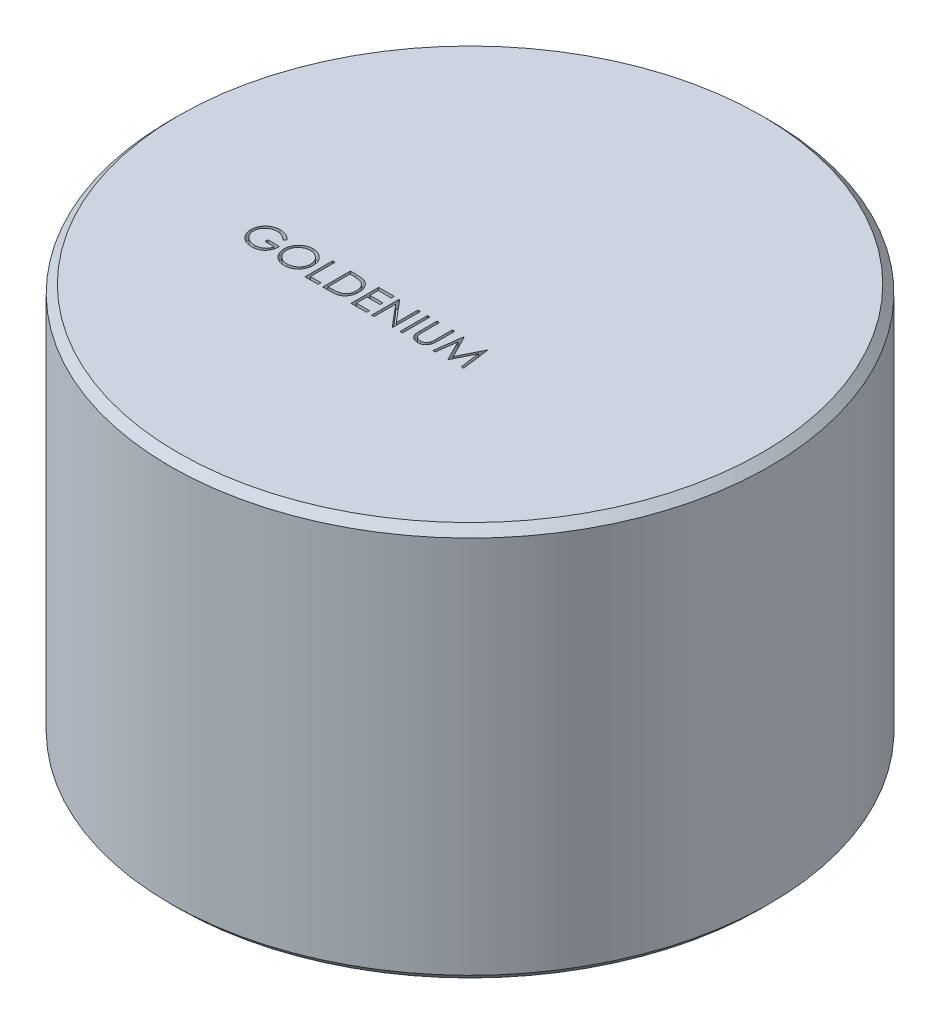
from build123d import *

# Parameters (mm, degrees)
ESQUISSE1_R             = 38
BOSS_EXTRU_1_DEPTH      = 50
CHANFREIN1_SIZE         = 1
CHANFREIN2_SIZE         = 1
ESQUISSE2_W             = 0.314102564
ESQUISSE2_H             = 3.5
ENL_V_MAT_EXTRU_1_DEPTH = 1
ESQUISSE3_W             = 0.314102564
ESQUISSE3_H             = 3.5
ENL_V_MAT_EXTRU_2_DEPTH = 1


with BuildPart() as part:
    # Esquisse1 → Boss.-Extru.1 (new body)
    with BuildSketch(Plane(origin=(0, 0, 0), x_dir=(1, 0, 0), z_dir=(0, 1, 0))):
        with Locations(Location((0, 0, 0), (0, 0, 270))):
            Circle(ESQUISSE1_R)
    extrude(amount=BOSS_EXTRU_1_DEPTH)

    # Chanfrein1
    chanfrein1_edges = [part.edges().sort_by_distance(p)[0] for p in [
        (0, 50, -38),
    ]]
    chamfer(chanfrein1_edges, length=CHANFREIN1_SIZE)

    # Chanfrein2
    chanfrein2_edges = [part.edges().sort_by_distance(p)[0] for p in [
        (0, 0, -38),
    ]]
    chamfer(chanfrein2_edges, length=CHANFREIN2_SIZE)

    # Esquisse2 → Enlèv. mat.-Extru.1 (cut)
    # profile 1 of 9: a face of its own
    with BuildSketch(Plane(origin=(0, 50, 0), x_dir=(1, 0, 0), z_dir=(0, 1, 0))):
        with BuildLine():
            Line((-16.448099285, -6.731593585), (-16.717330054, -6.986801918))
            add(Edge.make_bspline(
                [(-16.717330054, -6.986801918), (-16.766048943, -6.940971055), (-16.862324989, -6.850402192), (-17.019285232, -6.732891197), (-17.183048866, -6.632225097), (-17.352761363, -6.55031886), (-17.524219916, -6.4849661), (-17.695148693, -6.43843796), (-17.863794394, -6.408765422), (-17.975961612, -6.405217053), (-18.031232298, -6.403468585)],
                knots=[0, 0, 0, 0, 1.08915593, 2.152340314, 3.188132944, 4.216796309, 5.218260357, 6.173443236, 7.099959455, 8, 8, 8, 8], degree=3))
            add(Edge.make_bspline(
                [(-18.031232298, -6.403468585), (-18.065146998, -6.403882191), (-18.132888439, -6.40470833), (-18.233510383, -6.415252545), (-18.33307702, -6.430417409), (-18.431400394, -6.452359287), (-18.528671681, -6.480168346), (-18.624552573, -6.514953809), (-18.719221928, -6.555509054), (-18.811788009, -6.602371527), (-18.901528512, -6.653851374), (-18.986285348, -6.710899914), (-19.066598747, -6.771688704), (-19.140959172, -6.837739684), (-19.209794359, -6.908454549), (-19.274742731, -6.982517855), (-19.333520027, -7.061953074), (-19.386611192, -7.1452987), (-19.43397281, -7.231090889), (-19.475781463, -7.318503879), (-19.510878552, -7.407247733), (-19.538648007, -7.497433811), (-19.561558661, -7.588364401), (-19.577676268, -7.680669121), (-19.58676299, -7.774446807), (-19.58833477, -7.837244065), (-19.589124926, -7.868813136)],
                knots=[0, 0, 0, 0, 1.02818874, 2.053710826, 3.065248034, 4.081641283, 5.106893873, 6.131558223, 7.173050175, 8.228653731, 9.27666206, 10.308777013, 11.325269123, 12.329503258, 13.32196095, 14.316845687, 15.314881793, 16.315733098, 17.311955233, 18.285320748, 19.252783886, 20.203351036, 21.145449891, 22.095197417, 23.042428769, 24, 24, 24, 24], degree=3))
            add(Edge.make_bspline(
                [(-19.589124926, -7.868813136), (-19.588369208, -7.901083953), (-19.586859835, -7.965537467), (-19.577199515, -8.061731539), (-19.559271275, -8.156496942), (-19.535303566, -8.250145075), (-19.50532275, -8.342836323), (-19.467950084, -8.434168833), (-19.423684484, -8.524139224), (-19.372447932, -8.611936841), (-19.316261728, -8.697459864), (-19.253318647, -8.778019386), (-19.186458064, -8.854688163), (-19.113244164, -8.925763927), (-19.036024622, -8.993147823), (-18.952492346, -9.054983345), (-18.864289885, -9.112461568), (-18.771282673, -9.164858088), (-18.674479891, -9.211666624), (-18.575223138, -9.25329052), (-18.473195322, -9.287569857), (-18.368932633, -9.315507961), (-18.262559361, -9.338408258), (-18.153535558, -9.353140739), (-18.04266285, -9.363831569), (-17.967924218, -9.364613239), (-17.93027076, -9.365007046)],
                knots=[0, 0, 0, 0, 0.93586088, 1.869166235, 2.799637598, 3.729985548, 4.670839027, 5.622275134, 6.589130586, 7.576015415, 8.568469353, 9.55398029, 10.53834874, 11.515998671, 12.510579167, 13.508179873, 14.527009472, 15.561807829, 16.601455013, 17.643573243, 18.680854198, 19.719860599, 20.772568776, 21.833555941, 22.908541556, 24, 24, 24, 24], degree=3))
            add(Edge.make_bspline(
                [(-17.93027076, -9.365007046), (-17.884892412, -9.36405847), (-17.795784655, -9.362195786), (-17.664798212, -9.347695497), (-17.538995142, -9.325048703), (-17.418728938, -9.291882807), (-17.303859918, -9.249579132), (-17.193966976, -9.198583745), (-17.089915318, -9.136940686), (-16.991392144, -9.067366819), (-16.900634959, -8.989851986), (-16.818780835, -8.906207531), (-16.747135345, -8.816839465), (-16.684630646, -8.722274149), (-16.632921992, -8.621728844), (-16.590479197, -8.515696282), (-16.557945905, -8.40412877), (-16.54459093, -8.327037138), (-16.537842875, -8.288083969)],
                knots=[0, 0, 0, 0, 1.13008108, 2.219097802, 3.278683437, 4.311054135, 5.322181354, 6.324827112, 7.324222904, 8.330512327, 9.32562643, 10.293043162, 11.24128371, 12.174520618, 13.111833804, 14.052305215, 15.015860969, 16, 16, 16, 16], degree=3))
            Line((-16.537842875, -8.288083969), (-17.704509542, -8.288083969))
            Line((-17.704509542, -8.288083969), (-17.704509542, -7.92910961))
            Line((-17.704509542, -7.92910961), (-16.223740311, -7.92910961))
            add(Edge.make_bspline(
                [(-16.223740311, -7.92910961), (-16.225446159, -7.996017099), (-16.228784813, -8.126967141), (-16.252203728, -8.317937412), (-16.290020241, -8.498309105), (-16.341680552, -8.668272177), (-16.408555833, -8.82758577), (-16.489928361, -8.976411636), (-16.587100482, -9.113788317), (-16.696610924, -9.24083732), (-16.819510881, -9.354166532), (-16.952479501, -9.45377247), (-17.09573647, -9.537675086), (-17.249146277, -9.605935748), (-17.412206711, -9.659209743), (-17.585295091, -9.69698132), (-17.768176691, -9.719611283), (-17.893513368, -9.722502662), (-17.95761451, -9.723981405)],
                knots=[0, 0, 0, 0, 1.140356446, 2.231883559, 3.274166699, 4.278491846, 5.25512956, 6.21435461, 7.1637429, 8.11826594, 9.068280886, 10.0076534, 10.945064095, 11.891975133, 12.864533718, 13.863980011, 14.907571808, 16, 16, 16, 16], degree=3))
            add(Edge.make_bspline(
                [(-17.95761451, -9.723981405), (-17.997124645, -9.723412284), (-18.075051366, -9.722289794), (-18.190142294, -9.714312446), (-18.302059914, -9.70203187), (-18.410787923, -9.683486746), (-18.516726265, -9.660772092), (-18.61934585, -9.631685373), (-18.719037592, -9.598016674), (-18.815955578, -9.559721001), (-18.909220125, -9.515349344), (-18.999246642, -9.466039704), (-19.086532768, -9.412046344), (-19.170483933, -9.352435498), (-19.251537554, -9.287653038), (-19.329170998, -9.217569119), (-19.403818876, -9.142397999), (-19.450579339, -9.089018989), (-19.474140952, -9.062122431)],
                knots=[0, 0, 0, 0, 1.107784379, 2.184907829, 3.233506516, 4.263428166, 5.276301166, 6.270063455, 7.25232949, 8.225834625, 9.190232166, 10.146266622, 11.1027726, 12.066435141, 13.031522626, 14.010570082, 14.99756817, 16, 16, 16, 16], degree=3))
            add(Edge.make_bspline(
                [(-19.474140952, -9.062122431), (-19.508326884, -9.019451778), (-19.576131296, -8.934818761), (-19.663409453, -8.799218816), (-19.737810856, -8.658816956), (-19.798178678, -8.513222328), (-19.845316764, -8.362571115), (-19.879123017, -8.207055824), (-19.898930306, -8.046476193), (-19.901783844, -7.937810928), (-19.90322749, -7.882835572)],
                knots=[0, 0, 0, 0, 1.023165419, 2.029347347, 3.013907458, 3.994755782, 4.975994455, 5.96558838, 6.970761222, 8, 8, 8, 8], degree=3))
            add(Edge.make_bspline(
                [(-19.90322749, -7.882835572), (-19.902695252, -7.841669319), (-19.90163754, -7.759860012), (-19.888812024, -7.638402704), (-19.870410606, -7.519102012), (-19.843363552, -7.402055456), (-19.809267287, -7.287184864), (-19.766713801, -7.1744369), (-19.717168905, -7.063745029), (-19.659583409, -6.955871161), (-19.595498949, -6.852246748), (-19.525948729, -6.753288944), (-19.449945129, -6.66079988), (-19.368729329, -6.573608231), (-19.281332339, -6.492809384), (-19.188572915, -6.417655274), (-19.090379572, -6.348045088), (-18.986443392, -6.285075253), (-18.878315708, -6.228511633), (-18.766255706, -6.178922421), (-18.650297596, -6.137939105), (-18.531310118, -6.103165326), (-18.408392617, -6.077450185), (-18.28243708, -6.05880144), (-18.152786968, -6.04604084), (-18.065150939, -6.045014584), (-18.020715471, -6.044494226)],
                knots=[0, 0, 0, 0, 1.008945113, 2.00506715, 2.99143336, 3.967273523, 4.948097931, 5.927297278, 6.919902385, 7.919676788, 8.923139349, 9.905703106, 10.883022732, 11.856032218, 12.825136022, 13.798837087, 14.781400844, 15.773989409, 16.776158564, 17.77167057, 18.775803737, 19.789618931, 20.80898985, 21.851988756, 22.910860228, 24, 24, 24, 24], degree=3))
            add(Edge.make_bspline(
                [(-18.020715471, -6.044494226), (-17.984477227, -6.045073718), (-17.912621049, -6.046222782), (-17.805695316, -6.05418743), (-17.700422302, -6.066811311), (-17.596645912, -6.084038097), (-17.494719546, -6.107501788), (-17.39435284, -6.135580072), (-17.295400304, -6.168271895), (-17.198172055, -6.207260741), (-17.102014339, -6.251514366), (-17.006392498, -6.301327789), (-16.911633252, -6.357552793), (-16.817572271, -6.420356329), (-16.723616413, -6.488659747), (-16.631251771, -6.56441657), (-16.538248826, -6.644639326), (-16.478447012, -6.70232151), (-16.448099285, -6.731593585)],
                knots=[0, 0, 0, 0, 0.985871117, 1.954866573, 2.915460327, 3.869826059, 4.81536089, 5.759505086, 6.70452669, 7.649098992, 8.607881297, 9.583363685, 10.581137262, 11.603961102, 12.659522466, 13.73993555, 14.853081303, 16, 16, 16, 16], degree=3))
        make_face()
    # profile 2 of 9: a face of its own
    with BuildSketch(Plane(origin=(0, 50, 0), x_dir=(1, 0, 0), z_dir=(0, 1, 0))):
        with BuildLine():
            add(Edge.make_bspline(
                [(-13.86797108, -6.044494226), (-13.803162974, -6.046135705), (-13.675874507, -6.049359706), (-13.488799609, -6.07403881), (-13.310204514, -6.1167342), (-13.138634375, -6.173597182), (-12.976141399, -6.249451567), (-12.821502506, -6.341136716), (-12.675085632, -6.449613175), (-12.538864251, -6.574042401), (-12.414207301, -6.709425855), (-12.304381414, -6.853903765), (-12.212339121, -7.006602568), (-12.136753333, -7.167063398), (-12.077454724, -7.334923366), (-12.03653568, -7.511077369), (-12.01039753, -7.694384059), (-12.007341753, -7.819410924), (-12.005791593, -7.882835572)],
                knots=[0, 0, 0, 0, 1.065120563, 2.091984664, 3.0946048, 4.079830382, 5.057816894, 6.036188127, 7.030412546, 8.04752943, 9.064399622, 10.05169764, 11.02544977, 11.989514704, 12.962713494, 13.945757189, 14.957906945, 16, 16, 16, 16], degree=3))
            add(Edge.make_bspline(
                [(-12.005791593, -7.882835572), (-12.007341525, -7.945793018), (-12.010396622, -8.069889439), (-12.036565399, -8.252032883), (-12.077606399, -8.427123579), (-12.136202666, -8.594869232), (-12.211428144, -8.755446796), (-12.304083315, -8.90843375), (-12.413224526, -9.053880248), (-12.537431377, -9.190192913), (-12.672832419, -9.315190384), (-12.818062686, -9.42410926), (-12.969856006, -9.517833384), (-13.130165714, -9.592617058), (-13.296865751, -9.652388979), (-13.471448074, -9.693141609), (-13.653094628, -9.719428652), (-13.776965632, -9.722447168), (-13.839926208, -9.723981405)],
                knots=[0, 0, 0, 0, 1.043624062, 2.057103931, 3.04512605, 4.022047818, 4.998200453, 5.980619268, 6.982898556, 8.009068085, 9.034988726, 10.034168286, 11.015286542, 11.987931943, 12.962482838, 13.94673481, 14.956375938, 16, 16, 16, 16], degree=3))
            add(Edge.make_bspline(
                [(-13.839926208, -9.723981405), (-13.903350527, -9.722432018), (-14.028376743, -9.719377764), (-14.211913779, -9.69319636), (-14.388191522, -9.652255056), (-14.556705874, -9.59374562), (-14.717550803, -9.518128389), (-14.871040886, -9.42592401), (-15.016560033, -9.316516869), (-15.15290178, -9.192350294), (-15.277650978, -9.057178742), (-15.386410353, -8.912344487), (-15.478635467, -8.76068903), (-15.553998799, -8.601791506), (-15.613663259, -8.436420064), (-15.654368077, -8.263471586), (-15.680704029, -8.08393208), (-15.683738875, -7.961689182), (-15.685278772, -7.899662495)],
                knots=[0, 0, 0, 0, 1.053102029, 2.075944431, 3.073151272, 4.055350789, 5.033113405, 6.020478099, 7.024410459, 8.052272461, 9.079885166, 10.07527673, 11.055994387, 12.023226415, 12.992069828, 13.970394897, 14.97016774, 16, 16, 16, 16], degree=3))
            add(Edge.make_bspline(
                [(-15.685278772, -7.899662495), (-15.684744137, -7.858029826), (-15.68368161, -7.775289702), (-15.670889918, -7.652423102), (-15.652328217, -7.531532444), (-15.625726304, -7.412961496), (-15.590934637, -7.297000512), (-15.54988261, -7.182849749), (-15.499742765, -7.071666025), (-15.443062116, -6.962922633), (-15.379800308, -6.858314728), (-15.309924559, -6.759435144), (-15.235889191, -6.665454148), (-15.154725797, -6.578807144), (-15.069109352, -6.496973487), (-14.977650974, -6.42121077), (-14.880908729, -6.350835819), (-14.778466349, -6.287415478), (-14.672848075, -6.230056344), (-14.563971297, -6.180834493), (-14.453314725, -6.138588431), (-14.340360077, -6.104347606), (-14.225407305, -6.07731557), (-14.108205521, -6.058908216), (-13.988848094, -6.046083899), (-13.908436775, -6.045026397), (-13.86797108, -6.044494226)],
                knots=[0, 0, 0, 0, 1.037015668, 2.060948919, 3.074880161, 4.083647147, 5.086022904, 6.090072063, 7.104153813, 8.122640571, 9.144368836, 10.147691507, 11.138137339, 12.123020368, 13.103399296, 14.087645067, 15.080126199, 16.082011238, 17.087798457, 18.072939717, 19.057185487, 20.037253025, 21.01195951, 21.997135196, 22.992090687, 24, 24, 24, 24], degree=3))
        make_face()
        with BuildLine():
            add(Edge.make_bspline(
                [(-13.852546401, -6.403468585), (-13.885761034, -6.403873475), (-13.951872767, -6.404679385), (-14.050157303, -6.4152951), (-14.147149237, -6.430424989), (-14.242868599, -6.45200651), (-14.336914889, -6.481410563), (-14.43016473, -6.515251471), (-14.521767784, -6.556472562), (-14.611421642, -6.603045266), (-14.698336717, -6.654594187), (-14.780349418, -6.711565954), (-14.857672062, -6.772624508), (-14.930115329, -6.837912345), (-14.997466501, -6.907761947), (-15.061051202, -6.981114383), (-15.118320784, -7.060066274), (-15.170806361, -7.142476681), (-15.217774201, -7.228238262), (-15.259539556, -7.316448125), (-15.293703565, -7.407825811), (-15.321565941, -7.501379969), (-15.344665752, -7.596962429), (-15.359299676, -7.695298278), (-15.370032035, -7.79589339), (-15.370791881, -7.863875244), (-15.371176208, -7.898260251)],
                knots=[0, 0, 0, 0, 1.008559885, 2.007477868, 2.99961109, 3.989939068, 4.984837346, 5.991145699, 7.001802488, 8.033829008, 9.059044045, 10.069351652, 11.065060232, 12.050310815, 13.029377138, 14.011219647, 14.996725999, 15.989392538, 16.977580475, 17.965360261, 18.951710183, 19.937753436, 20.929683414, 21.935841486, 22.955955122, 24, 24, 24, 24], degree=3))
            add(Edge.make_bspline(
                [(-15.371176208, -7.898260251), (-15.369901346, -7.948822472), (-15.367393298, -8.048294002), (-15.345435728, -8.194062146), (-15.311613754, -8.334150433), (-15.261756387, -8.467792342), (-15.199405773, -8.596136625), (-15.122378882, -8.71804473), (-15.031119797, -8.833549604), (-14.92745627, -8.941844873), (-14.814133564, -9.040690677), (-14.693800834, -9.127454086), (-14.567747226, -9.200864336), (-14.435644024, -9.260669408), (-14.298196485, -9.308059146), (-14.154518934, -9.340537777), (-14.005568474, -9.361913232), (-13.904037819, -9.363965988), (-13.852546401, -9.365007046)],
                knots=[0, 0, 0, 0, 1.032063989, 2.030389145, 3.003944642, 3.970395727, 4.937377036, 5.913328081, 6.909231446, 7.93887556, 8.970685674, 9.976071282, 10.964166581, 11.944589148, 12.933237628, 13.927779006, 14.949070134, 16, 16, 16, 16], degree=3))
            add(Edge.make_bspline(
                [(-13.852546401, -9.365007046), (-13.817936899, -9.364531542), (-13.749295863, -9.363588474), (-13.64720034, -9.354089797), (-13.546944128, -9.338857928), (-13.448667849, -9.316927272), (-13.352483037, -9.289480066), (-13.257988234, -9.256872338), (-13.166189944, -9.216191134), (-13.075930106, -9.171243182), (-12.989533864, -9.120003025), (-12.907058332, -9.064964875), (-12.830582352, -9.003996255), (-12.758193281, -8.939678442), (-12.690565592, -8.870714594), (-12.628156607, -8.797194372), (-12.571176475, -8.718653715), (-12.518710829, -8.636368309), (-12.471907566, -8.550372057), (-12.431128467, -8.461842379), (-12.396532351, -8.370997269), (-12.368603846, -8.277705698), (-12.346718385, -8.182144849), (-12.331638465, -8.084186771), (-12.321090026, -7.984027428), (-12.320294949, -7.916283572), (-12.319894157, -7.88213445)],
                knots=[0, 0, 0, 0, 1.047197238, 2.076906641, 3.100256066, 4.114471768, 5.12198147, 6.126382909, 7.136867548, 8.15857795, 9.17633901, 10.174870724, 11.156907918, 12.133735059, 13.104061851, 14.077631395, 15.04955518, 16.038496417, 17.029181396, 18.010275684, 18.986308667, 19.968651475, 20.955262928, 21.950658345, 22.966943676, 24, 24, 24, 24], degree=3))
            add(Edge.make_bspline(
                [(-12.319894157, -7.88213445), (-12.32029527, -7.848218946), (-12.321090951, -7.780941296), (-12.331633426, -7.681480477), (-12.346734316, -7.584227266), (-12.368497024, -7.489563463), (-12.396547178, -7.397464938), (-12.431134509, -7.30801819), (-12.471919808, -7.220889995), (-12.518728032, -7.136295698), (-12.571343856, -7.05512096), (-12.628838099, -6.977518547), (-12.692203447, -6.904945806), (-12.759629472, -6.835611112), (-12.832800358, -6.770993223), (-12.911384652, -6.711070702), (-12.994428329, -6.654397428), (-13.082355565, -6.603271866), (-13.173099519, -6.556057633), (-13.266213477, -6.51560663), (-13.360642576, -6.48123451), (-13.456146688, -6.451917545), (-13.553529667, -6.430509515), (-13.652133496, -6.415281465), (-13.751821754, -6.40468308), (-13.818864974, -6.403874701), (-13.852546401, -6.403468585)],
                knots=[0, 0, 0, 0, 1.02996197, 2.043119294, 3.035359645, 4.018872909, 4.991431989, 5.957985074, 6.929999688, 7.912076566, 8.892894881, 9.867085534, 10.843653904, 11.817741046, 12.803660682, 13.806313499, 14.818574707, 15.856120519, 16.894564902, 17.924820532, 18.937903209, 19.946497019, 20.957711757, 21.963978472, 22.977135795, 24, 24, 24, 24], degree=3))
        make_face(mode=Mode.SUBTRACT)
    # profile 3 of 9: a face of its own
    with BuildSketch(Plane(origin=(0, 50, 0), x_dir=(1, 0, 0), z_dir=(0, 1, 0))):
        Polygon((-11.287842875, -6.134237816), (-10.973740311, -6.134237816), (-10.973740311, -9.275263457), (-9.627586465, -9.275263457), (-9.627586465, -9.634237816), (-11.287842875, -9.634237816), align=None)
    # profile 4 of 9: a face of its own
    with BuildSketch(Plane(origin=(0, 50, 0), x_dir=(1, 0, 0), z_dir=(0, 1, 0))):
        with BuildLine():
            Line((-9.044253131, -9.634237816), (-9.044253131, -6.134237816))
            Line((-9.044253131, -6.134237816), (-8.337522362, -6.134237816))
            add(Edge.make_bspline(
                [(-8.337522362, -6.134237816), (-8.276053374, -6.134680386), (-8.157295609, -6.135535428), (-7.985683161, -6.14095682), (-7.826899399, -6.150547285), (-7.68146654, -6.164516812), (-7.548985328, -6.181669845), (-7.429826719, -6.20317025), (-7.323374577, -6.22855842), (-7.257905136, -6.25020387), (-7.226945439, -6.260439739)],
                knots=[0, 0, 0, 0, 1.314313732, 2.53924729, 3.670748893, 4.714932338, 5.66265055, 6.526160246, 7.303039223, 8, 8, 8, 8], degree=3))
            add(Edge.make_bspline(
                [(-7.226945439, -6.260439739), (-7.1864507, -6.275870444), (-7.106379507, -6.306381938), (-6.992372385, -6.36393824), (-6.885047022, -6.429151341), (-6.783827877, -6.502107204), (-6.691027051, -6.584871553), (-6.603019154, -6.673928638), (-6.52340443, -6.772516978), (-6.450496134, -6.878591966), (-6.384760475, -6.990904019), (-6.327621317, -7.109239127), (-6.280167323, -7.232996335), (-6.240774097, -7.361831483), (-6.209727639, -7.496027861), (-6.188545708, -7.635741727), (-6.174574718, -7.780420917), (-6.173170666, -7.87859538), (-6.17245826, -7.928408489)],
                knots=[0, 0, 0, 0, 0.984719456, 1.947108742, 2.898477687, 3.838006223, 4.779231079, 5.722358779, 6.681677486, 7.655904652, 8.64651281, 9.637519902, 10.640069247, 11.656948941, 12.698408672, 13.768548281, 14.867775369, 16, 16, 16, 16], degree=3))
            add(Edge.make_bspline(
                [(-6.17245826, -7.928408489), (-6.173087227, -7.971669727), (-6.174326673, -8.056920516), (-6.185455989, -8.182561412), (-6.201632309, -8.304474983), (-6.226676507, -8.422080683), (-6.25707902, -8.536408901), (-6.296043172, -8.646241145), (-6.340678668, -8.752584955), (-6.392728546, -8.85400243), (-6.449869931, -8.950085803), (-6.511191675, -9.040661331), (-6.57662837, -9.124436553), (-6.646804003, -9.201665165), (-6.720811719, -9.272230743), (-6.79913605, -9.336722759), (-6.881979101, -9.393879313), (-6.968969823, -9.445946422), (-7.062645953, -9.491366777), (-7.164781819, -9.529796787), (-7.275812997, -9.561643402), (-7.395466954, -9.588214298), (-7.523950431, -9.609291601), (-7.661389397, -9.623417993), (-7.807572687, -9.632970926), (-7.907951952, -9.633807319), (-7.959617715, -9.634237816)],
                knots=[0, 0, 0, 0, 1.105936401, 2.179363191, 3.223086493, 4.248585256, 5.251745608, 6.245858792, 7.225916811, 8.198733463, 9.158002045, 10.082870192, 10.993790845, 11.873723703, 12.748670949, 13.606408763, 14.465103618, 15.319838547, 16.196477973, 17.123216899, 18.106603292, 19.147568657, 20.255746949, 21.433717677, 22.679120308, 24, 24, 24, 24], degree=3))
            Line((-7.959617715, -9.634237816), (-9.044253131, -9.634237816))
        make_face()
        with BuildLine():
            Line((-8.730150567, -9.275263457), (-8.328407779, -9.275263457))
            add(Edge.make_bspline(
                [(-8.328407779, -9.275263457), (-8.270679408, -9.27501536), (-8.15964661, -9.27453818), (-7.999988612, -9.270350977), (-7.854109216, -9.263509039), (-7.721987706, -9.253933962), (-7.603698682, -9.241265346), (-7.498994932, -9.227140444), (-7.408219674, -9.209542993), (-7.353290237, -9.193592033), (-7.327906977, -9.186220989)],
                knots=[0, 0, 0, 0, 1.375205317, 2.645023457, 3.804390687, 4.853969522, 5.800190428, 6.637939096, 7.370582563, 8, 8, 8, 8], degree=3))
            add(Edge.make_bspline(
                [(-7.327906977, -9.186220989), (-7.295958615, -9.17496943), (-7.232824977, -9.152735057), (-7.141943892, -9.112177396), (-7.057186887, -9.064135326), (-6.977076862, -9.010733052), (-6.902750207, -8.95008705), (-6.83332609, -8.883516061), (-6.768944289, -8.810681286), (-6.710269981, -8.731673125), (-6.657761677, -8.646983329), (-6.612290448, -8.557444495), (-6.572438916, -8.464037685), (-6.541160323, -8.365328527), (-6.516644739, -8.262199468), (-6.499280051, -8.154643255), (-6.488465327, -8.042679973), (-6.487203879, -7.966527849), (-6.486560824, -7.927707367)],
                knots=[0, 0, 0, 0, 0.998632004, 1.973411704, 2.929992603, 3.868527914, 4.809262121, 5.754881198, 6.702106254, 7.672490631, 8.653608572, 9.636854334, 10.631411391, 11.644891563, 12.686317036, 13.754757253, 14.855430412, 16, 16, 16, 16], degree=3))
            add(Edge.make_bspline(
                [(-6.486560824, -7.927707367), (-6.487074111, -7.886773886), (-6.488082469, -7.806359702), (-6.500756779, -7.688369007), (-6.519278334, -7.574888356), (-6.546062021, -7.465910161), (-6.580192899, -7.361221809), (-6.622787541, -7.261402299), (-6.67145416, -7.16539743), (-6.729357497, -7.075423064), (-6.792773091, -6.990329955), (-6.86315097, -6.912375039), (-6.939373008, -6.841380739), (-7.020607858, -6.776241426), (-7.109144957, -6.71957775), (-7.202898648, -6.668891069), (-7.303244319, -6.625875178), (-7.373057015, -6.602996315), (-7.408535984, -6.591369226)],
                knots=[0, 0, 0, 0, 1.122418816, 2.205001699, 3.251619955, 4.274784885, 5.280384055, 6.268708349, 7.249350384, 8.229342522, 9.199999885, 10.157847722, 11.105861043, 12.055065948, 13.010012805, 13.98527497, 14.976112212, 16, 16, 16, 16], degree=3))
            add(Edge.make_bspline(
                [(-7.408535984, -6.591369226), (-7.43788713, -6.583252798), (-7.500295721, -6.565995045), (-7.602135185, -6.547169673), (-7.716750334, -6.530565174), (-7.844650035, -6.516507134), (-7.985688494, -6.506419813), (-8.139974182, -6.498848498), (-8.307573787, -6.493741866), (-8.423756321, -6.493393159), (-8.484056817, -6.493212174)],
                knots=[0, 0, 0, 0, 0.674548936, 1.434276114, 2.292660221, 3.240891867, 4.284742987, 5.42552168, 6.663806718, 8, 8, 8, 8], degree=3))
            Line((-8.484056817, -6.493212174), (-8.730150567, -6.493212174))
            Line((-8.730150567, -6.493212174), (-8.730150567, -9.275263457))
        make_face(mode=Mode.SUBTRACT)
    # profile 5 of 9: a face of its own
    with BuildSketch(Plane(origin=(0, 50, 0), x_dir=(1, 0, 0), z_dir=(0, 1, 0))):
        Polygon((-5.454509542, -6.134237816), (-3.480150567, -6.134237816), (-3.480150567, -6.493212174), (-5.140406977, -6.493212174), (-5.140406977, -7.570135251), (-3.480150567, -7.570135251), (-3.480150567, -7.92910961), (-5.140406977, -7.92910961), (-5.140406977, -9.275263457), (-3.480150567, -9.275263457), (-3.480150567, -9.634237816), (-5.454509542, -9.634237816), align=None)
    # profile 6 of 9: a face of its own
    with BuildSketch(Plane(origin=(0, 50, 0), x_dir=(1, 0, 0), z_dir=(0, 1, 0))):
        Polygon((-2.851945439, -9.634237816), (-2.851945439, -6.134237816), (-2.78603999, -6.134237816), (-0.473740311, -8.888945348), (-0.473740311, -6.134237816), (-0.159637747, -6.134237816), (-0.159637747, -9.634237816), (-0.23115217, -9.634237816), (-2.537842875, -6.88584038), (-2.537842875, -9.634237816), align=None)
    # profile 7 of 9: a face of its own
    with BuildSketch(Plane(origin=(0, 50, 0), x_dir=(1, 0, 0), z_dir=(0, 1, 0))):
        with Locations((0.894849433, -7.884237816)):
            Rectangle(ESQUISSE2_W, ESQUISSE2_H)
    # profile 8 of 9: a face of its own
    with BuildSketch(Plane(origin=(0, 50, 0), x_dir=(1, 0, 0), z_dir=(0, 1, 0))):
        with BuildLine():
            Line((1.949336612, -6.134237816), (2.263439176, -6.134237816))
            Line((2.263439176, -6.134237816), (2.263439176, -8.231293104))
            add(Edge.make_bspline(
                [(2.263439176, -8.231293104), (2.263392432, -8.26097384), (2.263303728, -8.317298151), (2.263896242, -8.397466451), (2.26555561, -8.46873891), (2.26660177, -8.531390258), (2.268929103, -8.585133005), (2.27082715, -8.630258316), (2.273267707, -8.666552518), (2.276200824, -8.687733444), (2.277461612, -8.696837976)],
                knots=[0, 0, 0, 0, 1.528628734, 2.90083645, 4.128790002, 5.200304208, 6.127813768, 6.898992206, 7.526736466, 8, 8, 8, 8], degree=3))
            add(Edge.make_bspline(
                [(2.277461612, -8.696837976), (2.282639071, -8.729684739), (2.292702257, -8.793527468), (2.318348635, -8.88443575), (2.354166136, -8.966367208), (2.396609179, -9.041878499), (2.45254179, -9.10886786), (2.519545326, -9.170579512), (2.600723094, -9.224551317), (2.6909837, -9.273902129), (2.788268937, -9.313567211), (2.887680204, -9.343560575), (2.987723183, -9.361839475), (3.054699348, -9.363956014), (3.087958407, -9.365007046)],
                knots=[0, 0, 0, 0, 1.035780045, 2.013197591, 2.933192213, 3.817615948, 4.702609284, 5.640816605, 6.646850145, 7.73207398, 8.84249596, 9.914020372, 10.964143139, 12, 12, 12, 12], degree=3))
            add(Edge.make_bspline(
                [(3.087958407, -9.365007046), (3.116512148, -9.363933196), (3.173454709, -9.361791698), (3.25806114, -9.348530267), (3.340461249, -9.324629701), (3.421061929, -9.293789943), (3.496612913, -9.253042351), (3.567156355, -9.205971512), (3.630120289, -9.150760636), (3.687578287, -9.089660291), (3.737613223, -9.020720491), (3.780984365, -8.945442353), (3.816510294, -8.862693007), (3.834053819, -8.804538584), (3.84306658, -8.774662495)],
                knots=[0, 0, 0, 0, 0.994687771, 1.983630487, 2.973142513, 3.978332533, 4.983357753, 5.956394766, 6.925816176, 7.893390482, 8.871859704, 9.88551698, 10.913711441, 12, 12, 12, 12], degree=3))
            add(Edge.make_bspline(
                [(3.84306658, -8.774662495), (3.846066706, -8.762313921), (3.852752194, -8.734796321), (3.858999239, -8.68827503), (3.865505764, -8.633385666), (3.870020334, -8.569733853), (3.874421555, -8.497532881), (3.877054627, -8.416406623), (3.87827166, -8.326649662), (3.878634341, -8.264012501), (3.878823792, -8.231293104)],
                knots=[0, 0, 0, 0, 0.558680831, 1.244966039, 2.062412453, 2.990489873, 4.051219941, 5.244515665, 6.560634259, 8, 8, 8, 8], degree=3))
            Line((3.878823792, -8.231293104), (3.878823792, -6.134237816))
            Line((3.878823792, -6.134237816), (4.192926356, -6.134237816))
            Line((4.192926356, -6.134237816), (4.192926356, -8.248120027))
            add(Edge.make_bspline(
                [(4.192926356, -8.248120027), (4.192672235, -8.286218406), (4.192176304, -8.360569709), (4.187875728, -8.469521068), (4.181018728, -8.572874049), (4.17133064, -8.670642546), (4.158493637, -8.762476705), (4.144218416, -8.849181473), (4.126038883, -8.930134466), (4.104805482, -9.005966883), (4.080531934, -9.078152397), (4.049090785, -9.146661012), (4.013666286, -9.213575411), (3.971651633, -9.27788352), (3.92444025, -9.339870073), (3.870988569, -9.399159148), (3.813064408, -9.456698194), (3.749704849, -9.511011261), (3.681954324, -9.560819938), (3.610014366, -9.604617709), (3.534437596, -9.641641326), (3.45542047, -9.67211725), (3.372929267, -9.69503185), (3.286961907, -9.712107005), (3.197322714, -9.721809303), (3.136358058, -9.723251233), (3.105486452, -9.723981405)],
                knots=[0, 0, 0, 0, 1.316592851, 2.569410997, 3.76748051, 4.895814652, 5.963796859, 6.97159953, 7.931736103, 8.829262218, 9.692595152, 10.560224239, 11.431080259, 12.30701507, 13.211635791, 14.121146779, 15.063487852, 16.031507147, 17.00238618, 17.966455255, 18.938106653, 19.907068911, 20.888905087, 21.893141452, 22.933117798, 24, 24, 24, 24], degree=3))
            add(Edge.make_bspline(
                [(3.105486452, -9.723981405), (3.071817349, -9.72319664), (3.005758691, -9.721656933), (2.908420623, -9.712834183), (2.815106427, -9.696215789), (2.72483055, -9.675055845), (2.638822053, -9.645872108), (2.555928608, -9.611773983), (2.477569927, -9.569896723), (2.402474799, -9.52330333), (2.332650043, -9.470878692), (2.268552639, -9.413738518), (2.210076769, -9.35279814), (2.158208072, -9.287397774), (2.112087188, -9.218046067), (2.072356974, -9.144546828), (2.03824373, -9.066928511), (2.020637163, -9.012975311), (2.011736452, -8.985700155)],
                knots=[0, 0, 0, 0, 1.13879206, 2.234305948, 3.301075583, 4.341971843, 5.366689343, 6.369221514, 7.369726634, 8.367512178, 9.355451585, 10.318319045, 11.268648973, 12.207971039, 13.137398894, 14.081662264, 15.030215811, 16, 16, 16, 16], degree=3))
            add(Edge.make_bspline(
                [(2.011736452, -8.985700155), (2.006559294, -8.967067581), (1.995329922, -8.926653112), (1.983304625, -8.859766623), (1.973195543, -8.782751706), (1.963689985, -8.695603087), (1.958081027, -8.598253221), (1.953163588, -8.490744305), (1.94930197, -8.372946343), (1.949324742, -8.290891828), (1.949336612, -8.248120027)],
                knots=[0, 0, 0, 0, 0.625038921, 1.35572334, 2.194682327, 3.136881307, 4.189498639, 5.346923369, 6.617055217, 8, 8, 8, 8], degree=3))
            Line((1.949336612, -8.248120027), (1.949336612, -6.134237816))
        make_face()
    # profile 9 of 9: a face of its own
    with BuildSketch(Plane(origin=(0, 50, 0), x_dir=(1, 0, 0), z_dir=(0, 1, 0))):
        Polygon((4.910875074, -9.634237816), (5.372914337, -6.134237816), (5.417786132, -6.134237816), (6.862798151, -9.006032687), (8.304304561, -6.134237816), (8.349877478, -6.134237816), (8.814721228, -9.634237816), (8.49921642, -9.634237816), (8.164080202, -7.115808328), (6.900658728, -9.634237816), (6.829845426, -9.634237816), (5.561516099, -7.110199354), (5.227081003, -9.634237816), align=None)
    extrude(amount=-ENL_V_MAT_EXTRU_1_DEPTH, mode=Mode.SUBTRACT)

    # Esquisse3 → Enlèv. mat.-Extru.2 (cut)
    # profile 1 of 9: a face of its own
    with BuildSketch(Plane.XZ):
        with BuildLine():
            Line((-8.621004885, 16.271227751), (-8.890235654, 16.016019418))
            add(Edge.make_bspline(
                [(-8.890235654, 16.016019418), (-8.938954542, 16.061850281), (-9.035230589, 16.152419144), (-9.192190832, 16.269930139), (-9.355954466, 16.370596239), (-9.525666962, 16.452502475), (-9.697125516, 16.517855236), (-9.868054293, 16.564383376), (-10.036699994, 16.594055914), (-10.148867212, 16.597604283), (-10.204137898, 16.599352751)],
                knots=[0, 0, 0, 0, 1.08915593, 2.152340314, 3.188132944, 4.216796309, 5.218260357, 6.173443236, 7.099959455, 8, 8, 8, 8], degree=3))
            add(Edge.make_bspline(
                [(-10.204137898, 16.599352751), (-10.238052598, 16.598939145), (-10.305794038, 16.598113006), (-10.406415982, 16.587568791), (-10.505982619, 16.572403927), (-10.604305994, 16.550462049), (-10.701577281, 16.52265299), (-10.797458173, 16.487867526), (-10.892127528, 16.447312282), (-10.984693609, 16.400449808), (-11.074434112, 16.348969962), (-11.159190948, 16.291921421), (-11.239504347, 16.231132632), (-11.313864772, 16.165081652), (-11.382699959, 16.094366787), (-11.447648331, 16.020303481), (-11.506425626, 15.940868262), (-11.559516791, 15.857522636), (-11.60687841, 15.771730447), (-11.648687063, 15.684317457), (-11.683784151, 15.595573603), (-11.711553607, 15.505387525), (-11.734464261, 15.414456935), (-11.750581868, 15.322152215), (-11.75966859, 15.228374529), (-11.76124037, 15.165577271), (-11.762030526, 15.1340082)],
                knots=[0, 0, 0, 0, 1.02818874, 2.053710826, 3.065248034, 4.081641283, 5.106893873, 6.131558223, 7.173050175, 8.228653731, 9.27666206, 10.308777013, 11.325269123, 12.329503258, 13.32196095, 14.316845687, 15.314881793, 16.315733098, 17.311955233, 18.285320748, 19.252783886, 20.203351036, 21.145449891, 22.095197417, 23.042428769, 24, 24, 24, 24], degree=3))
            add(Edge.make_bspline(
                [(-11.762030526, 15.1340082), (-11.761274808, 15.101737383), (-11.759765435, 15.037283869), (-11.750105115, 14.941089796), (-11.732176875, 14.846324394), (-11.708209166, 14.752676261), (-11.67822835, 14.659985013), (-11.640855684, 14.568652503), (-11.596590084, 14.478682112), (-11.545353532, 14.390884495), (-11.489167328, 14.305361472), (-11.426224247, 14.22480195), (-11.359363664, 14.148133173), (-11.286149764, 14.077057409), (-11.208930222, 14.009673513), (-11.125397946, 13.947837991), (-11.037195485, 13.890359767), (-10.944188273, 13.837963248), (-10.847385491, 13.791154712), (-10.748128738, 13.749530816), (-10.646100922, 13.715251479), (-10.541838233, 13.687313375), (-10.435464961, 13.664413078), (-10.326441158, 13.649680597), (-10.21556845, 13.638989766), (-10.140829818, 13.638208096), (-10.103176359, 13.63781429)],
                knots=[0, 0, 0, 0, 0.93586088, 1.869166235, 2.799637598, 3.729985548, 4.670839027, 5.622275134, 6.589130586, 7.576015415, 8.568469353, 9.55398029, 10.53834874, 11.515998671, 12.510579167, 13.508179873, 14.527009472, 15.561807829, 16.601455013, 17.643573243, 18.680854198, 19.719860599, 20.772568776, 21.833555941, 22.908541556, 24, 24, 24, 24], degree=3))
            add(Edge.make_bspline(
                [(-10.103176359, 13.63781429), (-10.057798012, 13.638762866), (-9.968690255, 13.64062555), (-9.837703812, 13.655125839), (-9.711900741, 13.677772633), (-9.591634538, 13.710938529), (-9.476765517, 13.753242204), (-9.366872576, 13.804237591), (-9.262820917, 13.86588065), (-9.164297744, 13.935454517), (-9.073540558, 14.012969349), (-8.991686434, 14.096613805), (-8.920040945, 14.185981871), (-8.857536246, 14.280547187), (-8.805827592, 14.381092492), (-8.763384796, 14.487125054), (-8.730851505, 14.598692566), (-8.71749653, 14.675784198), (-8.710748475, 14.714737367)],
                knots=[0, 0, 0, 0, 1.13008108, 2.219097802, 3.278683437, 4.311054135, 5.322181354, 6.324827112, 7.324222904, 8.330512327, 9.32562643, 10.293043162, 11.24128371, 12.174520618, 13.111833804, 14.052305215, 15.015860969, 16, 16, 16, 16], degree=3))
            Line((-8.710748475, 14.714737367), (-9.877415141, 14.714737367))
            Line((-9.877415141, 14.714737367), (-9.877415141, 15.073711726))
            Line((-9.877415141, 15.073711726), (-8.396645911, 15.073711726))
            add(Edge.make_bspline(
                [(-8.396645911, 15.073711726), (-8.398351759, 15.006804237), (-8.401690412, 14.875854195), (-8.425109328, 14.684883924), (-8.46292584, 14.504512231), (-8.514586152, 14.334549159), (-8.581461433, 14.175235566), (-8.662833961, 14.0264097), (-8.760006082, 13.889033019), (-8.869516524, 13.761984016), (-8.992416481, 13.648654804), (-9.125385101, 13.549048866), (-9.26864207, 13.46514625), (-9.422051877, 13.396885588), (-9.585112311, 13.343611593), (-9.75820069, 13.305840016), (-9.941082291, 13.283210053), (-10.066418968, 13.280318674), (-10.130520109, 13.278839931)],
                knots=[0, 0, 0, 0, 1.140356446, 2.231883559, 3.274166699, 4.278491846, 5.25512956, 6.21435461, 7.1637429, 8.11826594, 9.068280886, 10.0076534, 10.945064095, 11.891975133, 12.864533718, 13.863980011, 14.907571808, 16, 16, 16, 16], degree=3))
            add(Edge.make_bspline(
                [(-10.130520109, 13.278839931), (-10.170030245, 13.279409052), (-10.247956966, 13.280531542), (-10.363047894, 13.28850889), (-10.474965514, 13.300789466), (-10.583693523, 13.31933459), (-10.689631865, 13.342049244), (-10.79225145, 13.371135963), (-10.891943192, 13.404804662), (-10.988861178, 13.443100335), (-11.082125725, 13.487471992), (-11.172152242, 13.536781631), (-11.259438367, 13.590774992), (-11.343389532, 13.650385838), (-11.424443154, 13.715168298), (-11.502076597, 13.785252217), (-11.576724476, 13.860423337), (-11.623484939, 13.913802346), (-11.647046552, 13.940698905)],
                knots=[0, 0, 0, 0, 1.107784379, 2.184907829, 3.233506516, 4.263428166, 5.276301166, 6.270063455, 7.25232949, 8.225834625, 9.190232166, 10.146266622, 11.1027726, 12.066435141, 13.031522626, 14.010570082, 14.99756817, 16, 16, 16, 16], degree=3))
            add(Edge.make_bspline(
                [(-11.647046552, 13.940698905), (-11.681232484, 13.983369558), (-11.749036896, 14.068002575), (-11.836315053, 14.20360252), (-11.910716456, 14.34400438), (-11.971084278, 14.489599008), (-12.018222364, 14.640250221), (-12.052028617, 14.795765512), (-12.071835906, 14.956345143), (-12.074689444, 15.065010407), (-12.07613309, 15.119985764)],
                knots=[0, 0, 0, 0, 1.023165419, 2.029347347, 3.013907458, 3.994755782, 4.975994455, 5.96558838, 6.970761222, 8, 8, 8, 8], degree=3))
            add(Edge.make_bspline(
                [(-12.07613309, 15.119985764), (-12.075600852, 15.161152017), (-12.07454314, 15.242961324), (-12.061717624, 15.364418632), (-12.043316206, 15.483719324), (-12.016269151, 15.60076588), (-11.982172887, 15.715636472), (-11.939619401, 15.828384436), (-11.890074505, 15.939076307), (-11.832489009, 16.046950175), (-11.768404549, 16.150574588), (-11.698854329, 16.249532391), (-11.622850728, 16.342021456), (-11.541634929, 16.429213105), (-11.454237939, 16.510011952), (-11.361478515, 16.585166062), (-11.263285172, 16.654776248), (-11.159348992, 16.717746083), (-11.051221308, 16.774309703), (-10.939161306, 16.823898915), (-10.823203195, 16.864882231), (-10.704215718, 16.89965601), (-10.581298217, 16.925371151), (-10.45534268, 16.944019896), (-10.325692568, 16.956780496), (-10.238056539, 16.957806752), (-10.193621071, 16.95832711)],
                knots=[0, 0, 0, 0, 1.008945113, 2.00506715, 2.99143336, 3.967273523, 4.948097931, 5.927297278, 6.919902385, 7.919676788, 8.923139349, 9.905703106, 10.883022732, 11.856032218, 12.825136022, 13.798837087, 14.781400844, 15.773989409, 16.776158564, 17.77167057, 18.775803737, 19.789618931, 20.80898985, 21.851988756, 22.910860228, 24, 24, 24, 24], degree=3))
            add(Edge.make_bspline(
                [(-10.193621071, 16.95832711), (-10.157382827, 16.957747618), (-10.085526648, 16.956598554), (-9.978600916, 16.948633906), (-9.873327902, 16.936010025), (-9.769551512, 16.918783239), (-9.667625145, 16.895319548), (-9.56725844, 16.867241263), (-9.468305904, 16.834549441), (-9.371077655, 16.795560595), (-9.274919939, 16.75130697), (-9.179298098, 16.701493547), (-9.084538852, 16.645268543), (-8.990477871, 16.582465007), (-8.896522013, 16.514161589), (-8.80415737, 16.438404766), (-8.711154426, 16.35818201), (-8.651352612, 16.300499826), (-8.621004885, 16.271227751)],
                knots=[0, 0, 0, 0, 0.985871117, 1.954866573, 2.915460327, 3.869826059, 4.81536089, 5.759505086, 6.70452669, 7.649098992, 8.607881297, 9.583363685, 10.581137262, 11.603961102, 12.659522466, 13.73993555, 14.853081303, 16, 16, 16, 16], degree=3))
        make_face()
    # profile 2 of 9: a face of its own
    with BuildSketch(Plane.XZ):
        with BuildLine():
            add(Edge.make_bspline(
                [(-6.04087668, 16.95832711), (-5.976068574, 16.956685631), (-5.848780107, 16.95346163), (-5.661705209, 16.928782526), (-5.483110114, 16.886087136), (-5.311539975, 16.829224154), (-5.149046999, 16.753369768), (-4.994408106, 16.66168462), (-4.847991232, 16.553208161), (-4.711769851, 16.428778935), (-4.5871129, 16.293395481), (-4.477287014, 16.148917571), (-4.38524472, 15.996218768), (-4.309658933, 15.835757938), (-4.250360324, 15.66789797), (-4.20944128, 15.491743967), (-4.18330313, 15.308437277), (-4.180247352, 15.183410412), (-4.178697193, 15.119985764)],
                knots=[0, 0, 0, 0, 1.065120563, 2.091984664, 3.0946048, 4.079830382, 5.057816894, 6.036188127, 7.030412546, 8.04752943, 9.064399622, 10.05169764, 11.02544977, 11.989514704, 12.962713494, 13.945757189, 14.957906945, 16, 16, 16, 16], degree=3))
            add(Edge.make_bspline(
                [(-4.178697193, 15.119985764), (-4.180247125, 15.057028318), (-4.183302222, 14.932931897), (-4.209470999, 14.750788453), (-4.250511999, 14.575697757), (-4.309108265, 14.407952104), (-4.384333744, 14.24737454), (-4.476988915, 14.094387586), (-4.586130126, 13.948941088), (-4.710336977, 13.812628423), (-4.845738019, 13.687630952), (-4.990968286, 13.578712076), (-5.142761606, 13.484987952), (-5.303071314, 13.410204278), (-5.469771351, 13.350432357), (-5.644353674, 13.309679727), (-5.826000228, 13.283392684), (-5.949871232, 13.280374168), (-6.012831808, 13.278839931)],
                knots=[0, 0, 0, 0, 1.043624062, 2.057103931, 3.04512605, 4.022047818, 4.998200453, 5.980619268, 6.982898556, 8.009068085, 9.034988726, 10.034168286, 11.015286542, 11.987931943, 12.962482838, 13.94673481, 14.956375938, 16, 16, 16, 16], degree=3))
            add(Edge.make_bspline(
                [(-6.012831808, 13.278839931), (-6.076256127, 13.280389317), (-6.201282343, 13.283443571), (-6.384819378, 13.309624976), (-6.561097122, 13.35056628), (-6.729611473, 13.409075716), (-6.890456403, 13.484692947), (-7.043946486, 13.576897326), (-7.189465633, 13.686304467), (-7.325807379, 13.810471042), (-7.450556578, 13.945642594), (-7.559315953, 14.090476849), (-7.651541067, 14.242132306), (-7.726904399, 14.40102983), (-7.786568858, 14.566401272), (-7.827273677, 14.73934975), (-7.853609629, 14.918889256), (-7.856644475, 15.041132154), (-7.858184372, 15.103158841)],
                knots=[0, 0, 0, 0, 1.053102029, 2.075944431, 3.073151272, 4.055350789, 5.033113405, 6.020478099, 7.024410459, 8.052272461, 9.079885166, 10.07527673, 11.055994387, 12.023226415, 12.992069828, 13.970394897, 14.97016774, 16, 16, 16, 16], degree=3))
            add(Edge.make_bspline(
                [(-7.858184372, 15.103158841), (-7.857649737, 15.14479151), (-7.85658721, 15.227531634), (-7.843795518, 15.350398234), (-7.825233817, 15.471288891), (-7.798631904, 15.589859839), (-7.763840237, 15.705820824), (-7.72278821, 15.819971587), (-7.672648364, 15.931155311), (-7.615967716, 16.039898702), (-7.552705908, 16.144506608), (-7.482830159, 16.243386191), (-7.40879479, 16.337367188), (-7.327631397, 16.424014192), (-7.242014952, 16.505847848), (-7.150556573, 16.581610565), (-7.053814329, 16.651985516), (-6.951371949, 16.715405857), (-6.845753674, 16.772764992), (-6.736876897, 16.821986843), (-6.626220325, 16.864232905), (-6.513265677, 16.89847373), (-6.398312905, 16.925505766), (-6.281111121, 16.943913119), (-6.161753694, 16.956737437), (-6.081342375, 16.957794939), (-6.04087668, 16.95832711)],
                knots=[0, 0, 0, 0, 1.037015668, 2.060948919, 3.074880161, 4.083647147, 5.086022904, 6.090072063, 7.104153813, 8.122640571, 9.144368836, 10.147691507, 11.138137339, 12.123020368, 13.103399296, 14.087645067, 15.080126199, 16.082011238, 17.087798457, 18.072939717, 19.057185487, 20.037253025, 21.01195951, 21.997135196, 22.992090687, 24, 24, 24, 24], degree=3))
        make_face()
        with BuildLine():
            add(Edge.make_bspline(
                [(-6.025452, 16.599352751), (-6.058666634, 16.598947861), (-6.124778367, 16.598141951), (-6.223062903, 16.587526236), (-6.320054837, 16.572396347), (-6.415774199, 16.550814826), (-6.509820488, 16.521410773), (-6.60307033, 16.487569865), (-6.694673384, 16.446348774), (-6.784327241, 16.39977607), (-6.871242317, 16.348227149), (-6.953255018, 16.291255382), (-7.030577662, 16.230196828), (-7.103020929, 16.16490899), (-7.170372101, 16.095059389), (-7.233956802, 16.021706953), (-7.291226384, 15.942755062), (-7.343711961, 15.860344655), (-7.390679801, 15.774583073), (-7.432445156, 15.686373211), (-7.466609165, 15.594995524), (-7.494471541, 15.501441367), (-7.517571352, 15.405858907), (-7.532205276, 15.307523058), (-7.542937635, 15.206927946), (-7.543697481, 15.138946092), (-7.544081808, 15.104561084)],
                knots=[0, 0, 0, 0, 1.008559885, 2.007477868, 2.99961109, 3.989939068, 4.984837346, 5.991145699, 7.001802488, 8.033829008, 9.059044045, 10.069351652, 11.065060232, 12.050310815, 13.029377138, 14.011219647, 14.996725999, 15.989392538, 16.977580475, 17.965360261, 18.951710183, 19.937753436, 20.929683414, 21.935841486, 22.955955122, 24, 24, 24, 24], degree=3))
            add(Edge.make_bspline(
                [(-7.544081808, 15.104561084), (-7.542806946, 15.053998864), (-7.540298898, 14.954527333), (-7.518341328, 14.80875919), (-7.484519354, 14.668670903), (-7.434661987, 14.535028994), (-7.372311373, 14.406684711), (-7.295284482, 14.284776606), (-7.204025397, 14.169271732), (-7.10036187, 14.060976463), (-6.987039164, 13.962130659), (-6.866706434, 13.87536725), (-6.740652826, 13.801957), (-6.608549623, 13.742151928), (-6.471102084, 13.69476219), (-6.327424533, 13.662283559), (-6.178474074, 13.640908104), (-6.076943419, 13.638855348), (-6.025452, 13.63781429)],
                knots=[0, 0, 0, 0, 1.032063989, 2.030389145, 3.003944642, 3.970395727, 4.937377036, 5.913328081, 6.909231446, 7.93887556, 8.970685674, 9.976071282, 10.964166581, 11.944589148, 12.933237628, 13.927779006, 14.949070134, 16, 16, 16, 16], degree=3))
            add(Edge.make_bspline(
                [(-6.025452, 13.63781429), (-5.990842499, 13.638289794), (-5.922201462, 13.639232862), (-5.82010594, 13.648731539), (-5.719849728, 13.663963408), (-5.621573448, 13.685894064), (-5.525388637, 13.71334127), (-5.430893834, 13.745948998), (-5.339095544, 13.786630202), (-5.248835706, 13.831578153), (-5.162439464, 13.882818311), (-5.079963932, 13.937856461), (-5.003487952, 13.998825081), (-4.931098881, 14.063142894), (-4.863471192, 14.132106742), (-4.801062207, 14.205626964), (-4.744082075, 14.284167621), (-4.691616429, 14.366453027), (-4.644813166, 14.452449279), (-4.604034067, 14.540978957), (-4.569437951, 14.631824067), (-4.541509446, 14.725115638), (-4.519623984, 14.820676487), (-4.504544065, 14.918634565), (-4.493995626, 15.018793907), (-4.493200549, 15.086537763), (-4.492799757, 15.120686886)],
                knots=[0, 0, 0, 0, 1.047197238, 2.076906641, 3.100256066, 4.114471768, 5.12198147, 6.126382909, 7.136867548, 8.15857795, 9.17633901, 10.174870724, 11.156907918, 12.133735059, 13.104061851, 14.077631395, 15.04955518, 16.038496417, 17.029181396, 18.010275684, 18.986308667, 19.968651475, 20.955262928, 21.950658345, 22.966943676, 24, 24, 24, 24], degree=3))
            add(Edge.make_bspline(
                [(-4.492799757, 15.120686886), (-4.49320087, 15.15460239), (-4.493996551, 15.22188004), (-4.504539026, 15.321340859), (-4.519639916, 15.41859407), (-4.541402624, 15.513257873), (-4.569452778, 15.605356398), (-4.604040108, 15.694803146), (-4.644825408, 15.781931341), (-4.691633632, 15.866525638), (-4.744249456, 15.947700376), (-4.801743699, 16.025302788), (-4.865109047, 16.09787553), (-4.932535072, 16.167210224), (-5.005705957, 16.231828113), (-5.084290251, 16.291750634), (-5.167333929, 16.348423908), (-5.255261165, 16.39954947), (-5.346005118, 16.446763703), (-5.439119076, 16.487214706), (-5.533548176, 16.521586825), (-5.629052288, 16.55090379), (-5.726435267, 16.572311821), (-5.825039096, 16.58753987), (-5.924727354, 16.598138256), (-5.991770574, 16.598946635), (-6.025452, 16.599352751)],
                knots=[0, 0, 0, 0, 1.02996197, 2.043119294, 3.035359645, 4.018872909, 4.991431989, 5.957985074, 6.929999688, 7.912076566, 8.892894881, 9.867085534, 10.843653904, 11.817741046, 12.803660682, 13.806313499, 14.818574707, 15.856120519, 16.894564902, 17.924820532, 18.937903209, 19.946497019, 20.957711757, 21.963978472, 22.977135795, 24, 24, 24, 24], degree=3))
        make_face(mode=Mode.SUBTRACT)
    # profile 3 of 9: a face of its own
    with BuildSketch(Plane.XZ):
        Polygon((-3.460748475, 16.86858352), (-3.146645911, 16.86858352), (-3.146645911, 13.727557879), (-1.800492064, 13.727557879), (-1.800492064, 13.36858352), (-3.460748475, 13.36858352), align=None)
    # profile 4 of 9: a face of its own
    with BuildSketch(Plane.XZ):
        with BuildLine():
            Line((-1.217158731, 13.36858352), (-1.217158731, 16.86858352))
            Line((-1.217158731, 16.86858352), (-0.510427962, 16.86858352))
            add(Edge.make_bspline(
                [(-0.510427962, 16.86858352), (-0.448958974, 16.86814095), (-0.330201208, 16.867285907), (-0.158588761, 16.861864516), (0.000195002, 16.85227405), (0.145627861, 16.838304524), (0.278109073, 16.821151491), (0.397267681, 16.799651086), (0.503719824, 16.774262916), (0.569189264, 16.752617466), (0.600148961, 16.742381597)],
                knots=[0, 0, 0, 0, 1.314313732, 2.53924729, 3.670748893, 4.714932338, 5.66265055, 6.526160246, 7.303039223, 8, 8, 8, 8], degree=3))
            add(Edge.make_bspline(
                [(0.600148961, 16.742381597), (0.6406437, 16.726950892), (0.720714893, 16.696439398), (0.834722015, 16.638883096), (0.942047378, 16.573669995), (1.043266523, 16.500714132), (1.13606735, 16.417949783), (1.224075246, 16.328892698), (1.30368997, 16.230304357), (1.376598266, 16.12422937), (1.442333926, 16.011917317), (1.499473083, 15.893582209), (1.546927077, 15.769825001), (1.586320303, 15.640989853), (1.617366761, 15.506793475), (1.638548693, 15.367079609), (1.652519682, 15.222400419), (1.653923734, 15.124225956), (1.654636141, 15.074412847)],
                knots=[0, 0, 0, 0, 0.984719456, 1.947108742, 2.898477687, 3.838006223, 4.779231079, 5.722358779, 6.681677486, 7.655904652, 8.64651281, 9.637519902, 10.640069247, 11.656948941, 12.698408672, 13.768548281, 14.867775369, 16, 16, 16, 16], degree=3))
            add(Edge.make_bspline(
                [(1.654636141, 15.074412847), (1.654007173, 15.031151609), (1.652767727, 14.94590082), (1.641638411, 14.820259924), (1.625462091, 14.698346353), (1.600417893, 14.580740653), (1.57001538, 14.466412435), (1.531051229, 14.356580191), (1.486415732, 14.250236381), (1.434365854, 14.148818905), (1.377224469, 14.052735533), (1.315902726, 13.962160005), (1.25046603, 13.878384783), (1.180290397, 13.801156171), (1.106282681, 13.730590593), (1.02795835, 13.666098577), (0.9451153, 13.608942023), (0.858124577, 13.556874914), (0.764448448, 13.511454559), (0.662312581, 13.473024549), (0.551281403, 13.441177934), (0.431627446, 13.414607038), (0.303143969, 13.393529735), (0.165705003, 13.379403343), (0.019521713, 13.36985041), (-0.080857552, 13.369014017), (-0.132523314, 13.36858352)],
                knots=[0, 0, 0, 0, 1.105936401, 2.179363191, 3.223086493, 4.248585256, 5.251745608, 6.245858792, 7.225916811, 8.198733463, 9.158002045, 10.082870192, 10.993790845, 11.873723703, 12.748670949, 13.606408763, 14.465103618, 15.319838547, 16.196477973, 17.123216899, 18.106603292, 19.147568657, 20.255746949, 21.433717677, 22.679120308, 24, 24, 24, 24], degree=3))
            Line((-0.132523314, 13.36858352), (-1.217158731, 13.36858352))
        make_face()
        with BuildLine():
            Line((-0.903056167, 13.727557879), (-0.501313379, 13.727557879))
            add(Edge.make_bspline(
                [(-0.501313379, 13.727557879), (-0.443585008, 13.727805976), (-0.332552209, 13.728283156), (-0.172894212, 13.732470359), (-0.027014816, 13.739312297), (0.105106694, 13.748887374), (0.223395718, 13.76155599), (0.328099468, 13.775680892), (0.418874726, 13.793278343), (0.473804163, 13.809229302), (0.499187423, 13.816600347)],
                knots=[0, 0, 0, 0, 1.375205317, 2.645023457, 3.804390687, 4.853969522, 5.800190428, 6.637939096, 7.370582563, 8, 8, 8, 8], degree=3))
            add(Edge.make_bspline(
                [(0.499187423, 13.816600347), (0.531135785, 13.827851906), (0.594269423, 13.850086279), (0.685150508, 13.89064394), (0.769907513, 13.93868601), (0.850017538, 13.992088284), (0.924344194, 14.052734286), (0.99376831, 14.119305275), (1.058150111, 14.19214005), (1.116824419, 14.271148211), (1.169332723, 14.355838007), (1.214803953, 14.44537684), (1.254655484, 14.538783651), (1.285934077, 14.637492809), (1.310449661, 14.740621868), (1.327814349, 14.848178081), (1.338629073, 14.960141363), (1.339890521, 15.036293487), (1.340533577, 15.075113969)],
                knots=[0, 0, 0, 0, 0.998632004, 1.973411704, 2.929992603, 3.868527914, 4.809262121, 5.754881198, 6.702106254, 7.672490631, 8.653608572, 9.636854334, 10.631411391, 11.644891563, 12.686317036, 13.754757253, 14.855430412, 16, 16, 16, 16], degree=3))
            add(Edge.make_bspline(
                [(1.340533577, 15.075113969), (1.340020289, 15.116047449), (1.339011932, 15.196461634), (1.326337621, 15.314452329), (1.307816066, 15.42793298), (1.28103238, 15.536911175), (1.246901501, 15.641599527), (1.204306859, 15.741419037), (1.15564024, 15.837423906), (1.097736903, 15.927398272), (1.03432131, 16.012491381), (0.96394343, 16.090446297), (0.887721392, 16.161440597), (0.806486542, 16.22657991), (0.717949443, 16.283243585), (0.624195752, 16.333930267), (0.523850081, 16.376946158), (0.454037385, 16.399825021), (0.418558416, 16.41145211)],
                knots=[0, 0, 0, 0, 1.122418816, 2.205001699, 3.251619955, 4.274784885, 5.280384055, 6.268708349, 7.249350384, 8.229342522, 9.199999885, 10.157847722, 11.105861043, 12.055065948, 13.010012805, 13.98527497, 14.976112212, 16, 16, 16, 16], degree=3))
            add(Edge.make_bspline(
                [(0.418558416, 16.41145211), (0.38920727, 16.419568538), (0.32679868, 16.436826291), (0.224959216, 16.455651663), (0.110344066, 16.472256162), (-0.017555635, 16.486314201), (-0.158594094, 16.496401523), (-0.312879782, 16.503972837), (-0.480479387, 16.50907947), (-0.59666192, 16.509428177), (-0.656962417, 16.509609161)],
                knots=[0, 0, 0, 0, 0.674548936, 1.434276114, 2.292660221, 3.240891867, 4.284742987, 5.42552168, 6.663806718, 8, 8, 8, 8], degree=3))
            Line((-0.656962417, 16.509609161), (-0.903056167, 16.509609161))
            Line((-0.903056167, 16.509609161), (-0.903056167, 13.727557879))
        make_face(mode=Mode.SUBTRACT)
    # profile 5 of 9: a face of its own
    with BuildSketch(Plane.XZ):
        Polygon((2.372584859, 16.86858352), (4.346943833, 16.86858352), (4.346943833, 16.509609161), (2.686687423, 16.509609161), (2.686687423, 15.432686084), (4.346943833, 15.432686084), (4.346943833, 15.073711726), (2.686687423, 15.073711726), (2.686687423, 13.727557879), (4.346943833, 13.727557879), (4.346943833, 13.36858352), (2.372584859, 13.36858352), align=None)
    # profile 6 of 9: a face of its own
    with BuildSketch(Plane.XZ):
        Polygon((4.975148961, 13.36858352), (4.975148961, 16.86858352), (5.04105441, 16.86858352), (7.353354089, 14.113875988), (7.353354089, 16.86858352), (7.667456653, 16.86858352), (7.667456653, 13.36858352), (7.59594223, 13.36858352), (5.289251525, 16.116980956), (5.289251525, 13.36858352), align=None)
    # profile 7 of 9: a face of its own
    with BuildSketch(Plane.XZ):
        with Locations((8.721943833, 15.11858352)):
            Rectangle(ESQUISSE3_W, ESQUISSE3_H)
    # profile 8 of 9: a face of its own
    with BuildSketch(Plane.XZ):
        with BuildLine():
            Line((9.776431012, 16.86858352), (10.090533577, 16.86858352))
            Line((10.090533577, 16.86858352), (10.090533577, 14.771528232))
            add(Edge.make_bspline(
                [(10.090533577, 14.771528232), (10.090486833, 14.741847496), (10.090398128, 14.685523185), (10.090990642, 14.605354885), (10.09265001, 14.534082426), (10.09369617, 14.471431078), (10.096023503, 14.417688331), (10.09792155, 14.37256302), (10.100362107, 14.336268817), (10.103295224, 14.315087891), (10.104556012, 14.30598336)],
                knots=[0, 0, 0, 0, 1.528628734, 2.90083645, 4.128790002, 5.200304208, 6.127813768, 6.898992206, 7.526736466, 8, 8, 8, 8], degree=3))
            add(Edge.make_bspline(
                [(10.104556012, 14.30598336), (10.109733471, 14.273136597), (10.119796658, 14.209293868), (10.145443035, 14.118385586), (10.181260536, 14.036454128), (10.223703579, 13.960942836), (10.27963619, 13.893953476), (10.346639726, 13.832241824), (10.427817494, 13.778270019), (10.5180781, 13.728919207), (10.615363337, 13.689254125), (10.714774604, 13.65926076), (10.814817583, 13.640981861), (10.881793748, 13.638865322), (10.915052807, 13.63781429)],
                knots=[0, 0, 0, 0, 1.035780045, 2.013197591, 2.933192213, 3.817615948, 4.702609284, 5.640816605, 6.646850145, 7.73207398, 8.84249596, 9.914020372, 10.964143139, 12, 12, 12, 12], degree=3))
            add(Edge.make_bspline(
                [(10.915052807, 13.63781429), (10.943606548, 13.63888814), (11.00054911, 13.641029638), (11.08515554, 13.654291069), (11.167555649, 13.678191635), (11.248156329, 13.709031393), (11.323707313, 13.749778984), (11.394250755, 13.796849824), (11.45721469, 13.8520607), (11.514672687, 13.913161044), (11.564707623, 13.982100844), (11.608078765, 14.057378982), (11.643604694, 14.140128329), (11.661148219, 14.198282752), (11.67016098, 14.228158841)],
                knots=[0, 0, 0, 0, 0.994687771, 1.983630487, 2.973142513, 3.978332533, 4.983357753, 5.956394766, 6.925816176, 7.893390482, 8.871859704, 9.88551698, 10.913711441, 12, 12, 12, 12], degree=3))
            add(Edge.make_bspline(
                [(11.67016098, 14.228158841), (11.673161106, 14.240507415), (11.679846594, 14.268025015), (11.686093639, 14.314546306), (11.692600164, 14.36943567), (11.697114734, 14.433087483), (11.701515955, 14.505288455), (11.704149027, 14.586414713), (11.70536606, 14.676171674), (11.705728741, 14.738808835), (11.705918192, 14.771528232)],
                knots=[0, 0, 0, 0, 0.558680831, 1.244966039, 2.062412453, 2.990489873, 4.051219941, 5.244515665, 6.560634259, 8, 8, 8, 8], degree=3))
            Line((11.705918192, 14.771528232), (11.705918192, 16.86858352))
            Line((11.705918192, 16.86858352), (12.020020756, 16.86858352))
            Line((12.020020756, 16.86858352), (12.020020756, 14.754701309))
            add(Edge.make_bspline(
                [(12.020020756, 14.754701309), (12.019766636, 14.71660293), (12.019270704, 14.642251627), (12.014970128, 14.533300268), (12.008113128, 14.429947287), (11.99842504, 14.33217879), (11.985588037, 14.240344631), (11.971312816, 14.153639863), (11.953133283, 14.07268687), (11.931899882, 13.996854452), (11.907626334, 13.924668939), (11.876185186, 13.856160324), (11.840760686, 13.789245925), (11.798746033, 13.724937816), (11.75153465, 13.662951263), (11.698082969, 13.603662188), (11.640158809, 13.546123141), (11.576799249, 13.491810075), (11.509048724, 13.442001398), (11.437108766, 13.398203627), (11.361531996, 13.36118001), (11.28251487, 13.330704085), (11.200023667, 13.307789486), (11.114056308, 13.29071433), (11.024417114, 13.281012033), (10.963452458, 13.279570103), (10.932580852, 13.278839931)],
                knots=[0, 0, 0, 0, 1.316592851, 2.569410997, 3.76748051, 4.895814652, 5.963796859, 6.97159953, 7.931736103, 8.829262218, 9.692595152, 10.560224239, 11.431080259, 12.30701507, 13.211635791, 14.121146779, 15.063487852, 16.031507147, 17.00238618, 17.966455255, 18.938106653, 19.907068911, 20.888905087, 21.893141452, 22.933117798, 24, 24, 24, 24], degree=3))
            add(Edge.make_bspline(
                [(10.932580852, 13.278839931), (10.89891175, 13.279624696), (10.832853091, 13.281164403), (10.735515023, 13.289987153), (10.642200827, 13.306605547), (10.55192495, 13.327765491), (10.465916453, 13.356949228), (10.383023009, 13.391047353), (10.304664327, 13.432924613), (10.229569199, 13.479518006), (10.159744443, 13.531942644), (10.09564704, 13.589082818), (10.037171169, 13.650023196), (9.985302473, 13.715423561), (9.939181588, 13.784775268), (9.899451375, 13.858274508), (9.865338131, 13.935892824), (9.847731563, 13.989846025), (9.838830852, 14.017121181)],
                knots=[0, 0, 0, 0, 1.13879206, 2.234305948, 3.301075583, 4.341971843, 5.366689343, 6.369221514, 7.369726634, 8.367512178, 9.355451585, 10.318319045, 11.268648973, 12.207971039, 13.137398894, 14.081662264, 15.030215811, 16, 16, 16, 16], degree=3))
            add(Edge.make_bspline(
                [(9.838830852, 14.017121181), (9.833653694, 14.035753755), (9.822424323, 14.076168224), (9.810399025, 14.143054713), (9.800289943, 14.22006963), (9.790784385, 14.307218249), (9.785175427, 14.404568115), (9.780257988, 14.512077031), (9.77639637, 14.629874993), (9.776419142, 14.711929508), (9.776431012, 14.754701309)],
                knots=[0, 0, 0, 0, 0.625038921, 1.35572334, 2.194682327, 3.136881307, 4.189498639, 5.346923369, 6.617055217, 8, 8, 8, 8], degree=3))
            Line((9.776431012, 14.754701309), (9.776431012, 16.86858352))
        make_face()
    # profile 9 of 9: a face of its own
    with BuildSketch(Plane.XZ):
        Polygon((12.737969474, 13.36858352), (13.200008737, 16.86858352), (13.244880532, 16.86858352), (14.689892551, 13.996788649), (16.131398961, 16.86858352), (16.176971878, 16.86858352), (16.641815628, 13.36858352), (16.32631082, 13.36858352), (15.991174602, 15.887013008), (14.727753128, 13.36858352), (14.656939827, 13.36858352), (13.3886105, 15.892621982), (13.054175403, 13.36858352), align=None)
    extrude(amount=-ENL_V_MAT_EXTRU_2_DEPTH, mode=Mode.SUBTRACT)


solid = part.part
